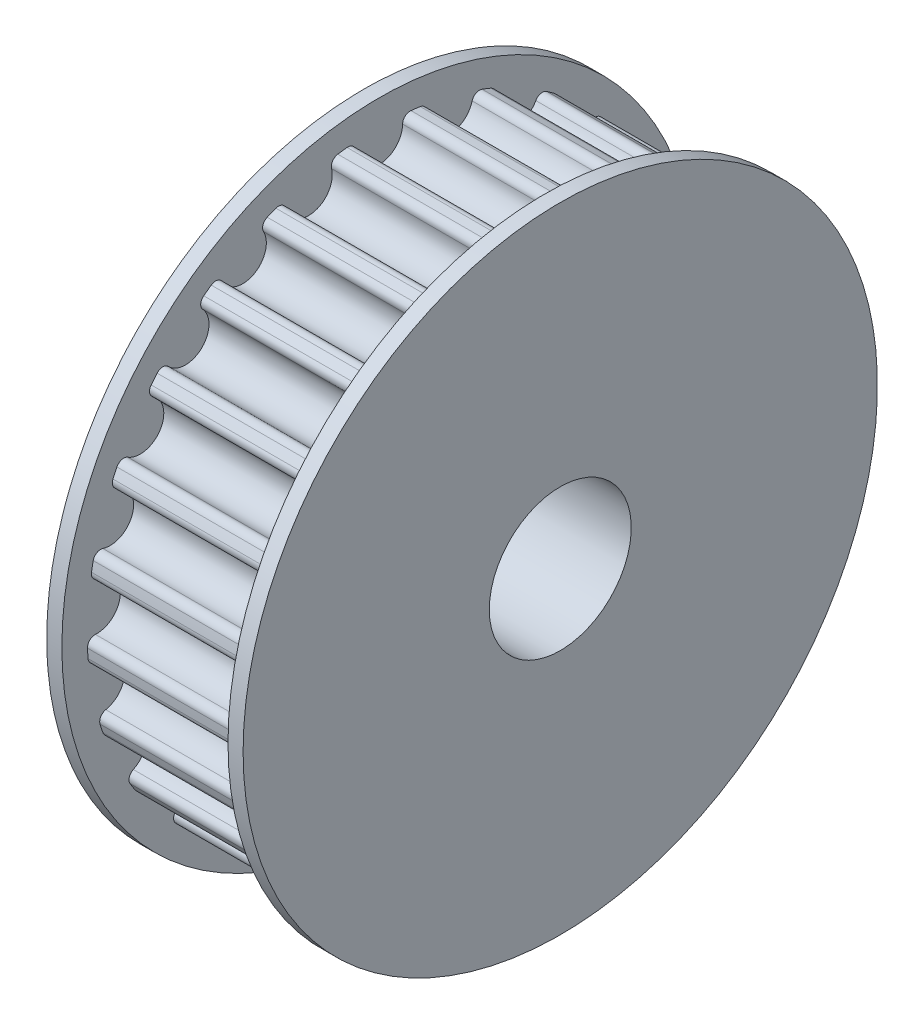
from build123d import *

# Parameters (mm, degrees)
SKETCH_3_OUTSIDE_W        = 52.04
SKETCH_3_OUTSIDE_H        = 52.04
CUT_EXTRUDE_3_DEPTH       = 5.5
PATTERN_CIRCULAR_2_COUNT  = 25
SKETCH_7_R                = 5
CUT_EXTRUDE_4_DEPTH       = 36.616007637
CUT_EXTRUDE_25_DEPTH      = 33.810059433
CUT_EXTRUDE_25_DEPTH_BACK = 33.810059433
SKETCH_42_W               = 11.690908627
SKETCH_42_H               = 55.464155105
SKETCH_42_W_2             = 17.903263655
SKETCH_42_H_2             = 55.986187397
CUT_EXTRUDE_27_DEPTH      = 35.372954485
CUT_EXTRUDE_27_DEPTH_BACK = 35.372954485
SKETCH_43_R               = 22.5
SKETCH_43_R_2             = 21
SKETCH_44_R               = 5
SKETCH_44_R_2             = 4.7
EXTRUDE_1_DEPTH           = 13


with BuildPart() as part:
    # 草图1 → 旋转1 (revolve)
    with BuildSketch(Plane.XY, mode=Mode.PRIVATE) as revolve_1_sk:
        Polygon((-8, 15), (-5.5, 15), (-5.5, 19.325), (5.5, 19.325), (5.5, 15), (8, 15), (8, 0), (-8, 0), align=None)
    revolve(revolve_1_sk.sketch.rotate(Axis((-8, 0, 0), (1, 0, 0)), 90), axis=Axis((-8, 0, 0), (1, 0, 0)))

    # 草图3 outside → 切除-拉伸3 (cut, symmetric)
    with BuildSketch(Plane(origin=(0, 0, 0), x_dir=(0, 0, -1), z_dir=(1, 0, 0))):
        Rectangle(SKETCH_3_OUTSIDE_W, SKETCH_3_OUTSIDE_H)
        with BuildLine():
            ThreePointArc((-2.114672063, 19.208950702), (0, -19.325), (2.114672063, 19.208950702))
            ThreePointArc((2.114672063, 19.208950702), (1.727490621, 19.085403384), (1.559968713, 18.715119953))
            ThreePointArc((1.559968713, 18.715119953), (0, 17.165), (-1.559968713, 18.715119953))
            ThreePointArc((-1.559968713, 18.715119953), (-1.727490621, 19.085403384), (-2.114672063, 19.208950702))
        make_face(mode=Mode.SUBTRACT)
    cut_extrude_3 = extrude(amount=CUT_EXTRUDE_3_DEPTH, both=True, mode=Mode.SUBTRACT)

    # 阵列(圆周)2: 切除-拉伸3 ×25 about axis
    pattern_circular_2_axis = Axis((0, 0, 0), (1, 0, 0))
    for i in range(1, PATTERN_CIRCULAR_2_COUNT):
        add(cut_extrude_3.rotate(pattern_circular_2_axis, i * 360 / PATTERN_CIRCULAR_2_COUNT), mode=Mode.SUBTRACT)

    # 草图4 → 旋转2 (revolve)
    with BuildSketch(Plane.XY, mode=Mode.PRIVATE) as revolve_2_sk:
        Polygon((-7, 22.5), (-7, 15), (-5.5, 15), (-5.5, 21), (-5.901923789, 22.5), align=None)
        Polygon((7, 22.5), (7, 15), (5.5, 15), (5.5, 21), (5.901923789, 22.5), align=None)
    revolve(revolve_2_sk.sketch.rotate(Axis((-8, 0, 0), (1, 0, 0)), 180), axis=Axis((-8, 0, 0), (1, 0, 0)))

    # 草图7 → 切除-拉伸4 (cut, through all)
    with BuildSketch(Plane.ZY.offset(8)):
        Circle(SKETCH_7_R)
    extrude(amount=-CUT_EXTRUDE_4_DEPTH, mode=Mode.SUBTRACT)

    # 草图42 → 切除-拉伸25 (cut, two sides: drawn at the far end of the back side and taken through both)
    with BuildSketch(Plane(origin=(0, 0, 0), x_dir=(1, 0, 0), z_dir=(0, 1, 0)).offset(-CUT_EXTRUDE_25_DEPTH_BACK)):
        with Locations((-12.345454314, 2.796156441)):
            Rectangle(SKETCH_42_W, SKETCH_42_H)
        with Locations((15.451631827, 4.731003793)):
            Rectangle(SKETCH_42_W_2, SKETCH_42_H_2)
    extrude(amount=CUT_EXTRUDE_25_DEPTH + CUT_EXTRUDE_25_DEPTH_BACK, mode=Mode.SUBTRACT)

    # 草图43 → 切除-拉伸27 (cut, two sides: drawn at the far end of the back side and taken through both)
    with BuildSketch(Plane.ZY.offset(6.5).offset(-CUT_EXTRUDE_27_DEPTH_BACK)):
        Circle(SKETCH_43_R)
        Circle(SKETCH_43_R_2, mode=Mode.SUBTRACT)
    extrude(amount=CUT_EXTRUDE_27_DEPTH + CUT_EXTRUDE_27_DEPTH_BACK, mode=Mode.SUBTRACT)

    # 草图44 → 凸台-拉伸1 (add)
    with BuildSketch(Plane.ZY.offset(6.5)):
        Circle(SKETCH_44_R)
        Circle(SKETCH_44_R_2, mode=Mode.SUBTRACT)
    extrude(amount=-EXTRUDE_1_DEPTH)


solid = part.part
